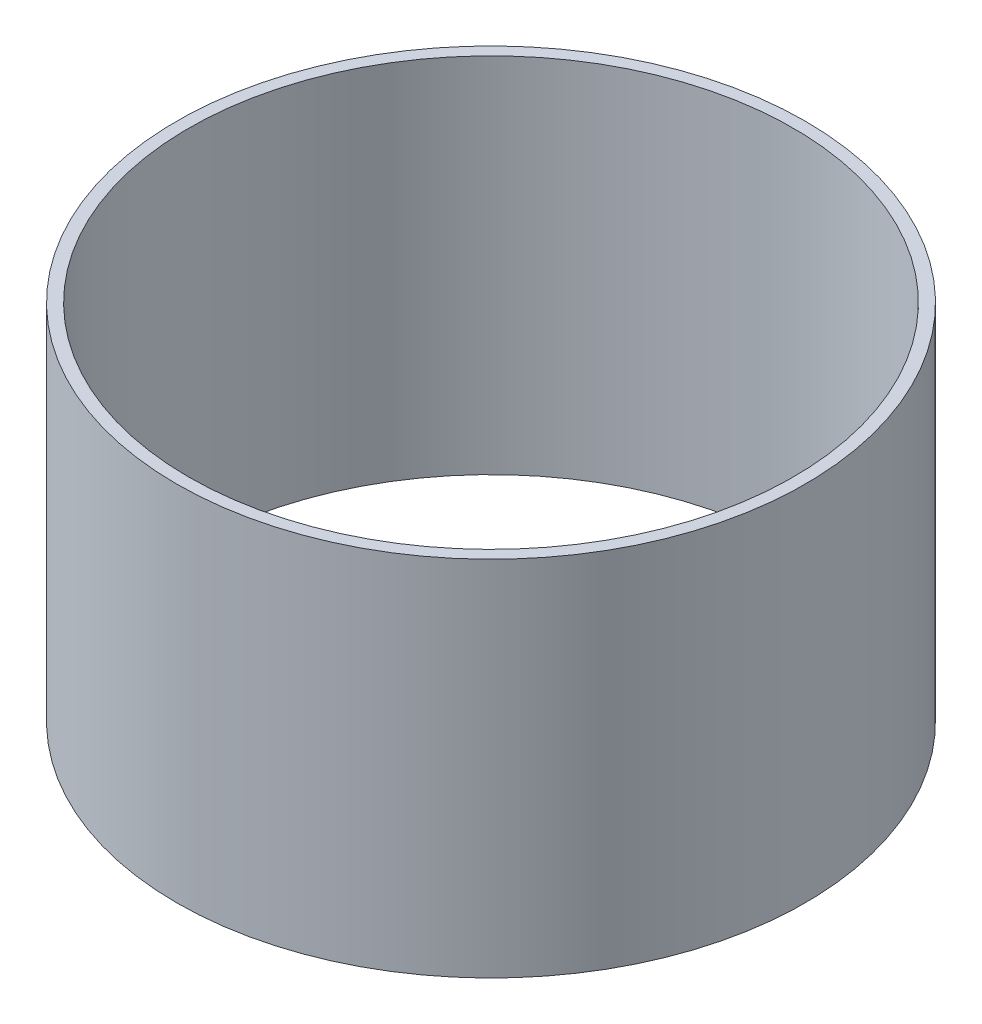
from build123d import *

# Parameters (mm, degrees)
SKETCH1_R           = 26
SKETCH1_R_2         = 25
BOSS_EXTRUDE1_DEPTH = 30


with BuildPart() as part:
    # Sketch1 → Boss-Extrude1 (new body)
    with BuildSketch(Plane(origin=(0, 0, 0), x_dir=(1, 0, 0), z_dir=(0, 1, 0))):
        with Locations(Location((0, 0, 0), (0, 0, 270))):
            Circle(SKETCH1_R)
        with Locations(Location((0, 0, 0), (0, 0, 270))):
            Circle(SKETCH1_R_2, mode=Mode.SUBTRACT)
    extrude(amount=BOSS_EXTRUDE1_DEPTH)


solid = part.part
